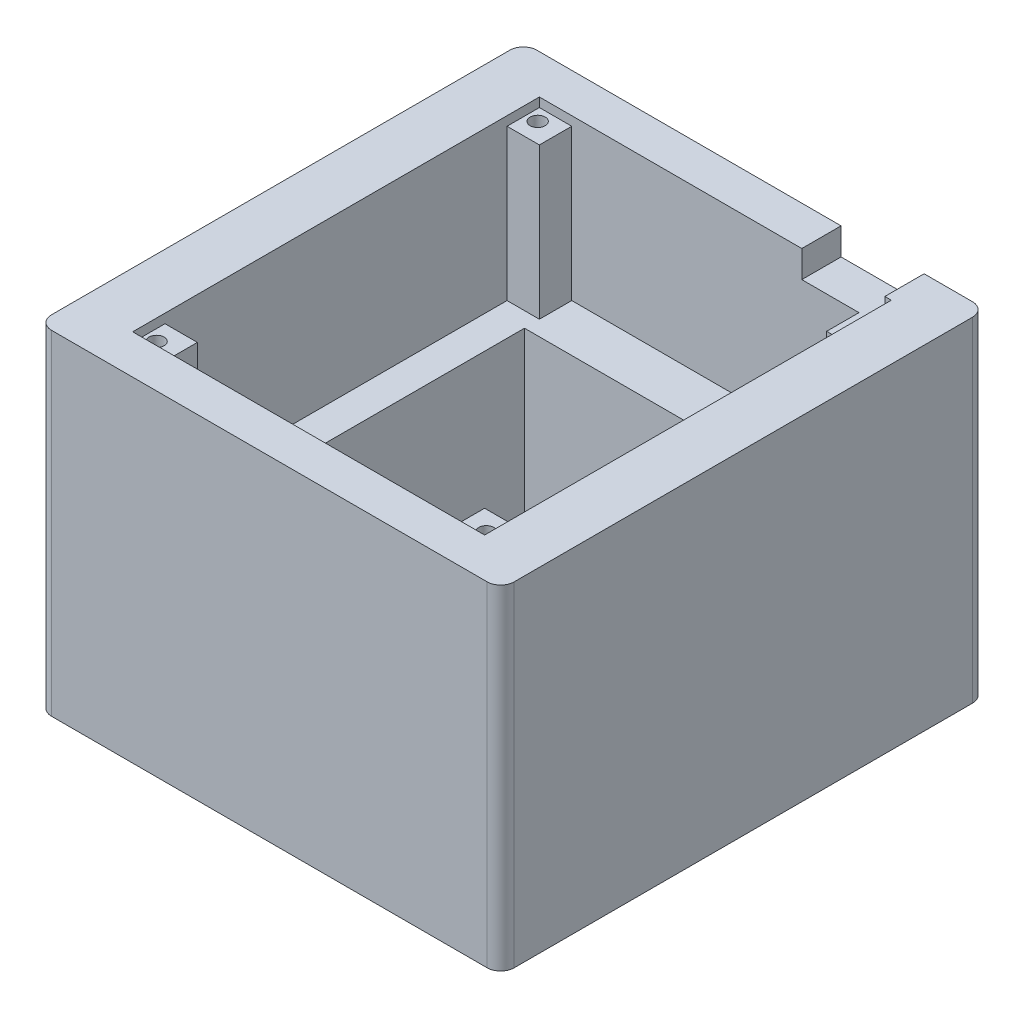
from build123d import *

# Parameters (mm, degrees)
SKETCH_1_W          = 85.8
SKETCH_1_H          = 90
SKETCH_1_R          = 1.33793637
SKETCH_1_W_2        = 53.17
SKETCH_1_H_2        = 57.8
EXTRUDE_1_DEPTH     = 20
SKETCH_3_W          = 85.8
SKETCH_3_H          = 90
SKETCH_3_W_2        = 53.17
SKETCH_3_H_2        = 57.8
EXTRUDE_2_DEPTH     = 42
SKETCH_5_R          = 1.4
CUT_EXTRUDE_2_DEPTH = 20
SKETCH_5_6_W        = 65.278
SKETCH_5_6_H        = 75.438
CUT_EXTRUDE_3_DEPTH = 1.7
CUT_EXTRUDE_4_DEPTH = 28
SKETCH_8_W          = 15.4
SKETCH_8_H          = 7.281
CUT_EXTRUDE_5_DEPTH = 5
FILLET_1_R          = 2.5
FILLET_2_R          = 2.5
FILLET_3_R          = 2.5
FILLET_4_R          = 2.5
SKETCH_11_W         = 4.79539709
SKETCH_11_H         = 3.3
CUT_EXTRUDE_6_DEPTH = 10


with BuildPart() as part:
    # 草图1 → 凸台-拉伸1 (new body)
    with BuildSketch(Plane(origin=(0, 0, 0), x_dir=(1, 0, 0), z_dir=(0, 1, 0))):
        with Locations((38.264980184, 40.138091102)):
            Rectangle(SKETCH_1_W, SKETCH_1_H)
        with Locations((1.744980184, 9.838091102)):
            Circle(SKETCH_1_R, mode=Mode.SUBTRACT)
        with Locations((74.784980184, 9.838091102)):
            Circle(SKETCH_1_R, mode=Mode.SUBTRACT)
        with Locations((74.784980184, 70.438091102)):
            Circle(SKETCH_1_R, mode=Mode.SUBTRACT)
        with Locations((1.744980184, 70.438091102)):
            Circle(SKETCH_1_R, mode=Mode.SUBTRACT)
        with Locations((38.264980184, 40.138091102)):
            Rectangle(SKETCH_1_W_2, SKETCH_1_H_2, mode=Mode.SUBTRACT)
    extrude(amount=EXTRUDE_1_DEPTH)

    # 草图3 → 凸台-拉伸2 (add)
    with BuildSketch(Plane(origin=(0, 20, 0), x_dir=(1, 0, 0), z_dir=(0, 1, 0))):
        with Locations((38.264980184, 40.138091102)):
            Rectangle(SKETCH_3_W, SKETCH_3_H)
        with Locations((38.264980184, 40.138091102)):
            Rectangle(SKETCH_3_W_2, SKETCH_3_H_2, mode=Mode.SUBTRACT)
    extrude(amount=EXTRUDE_2_DEPTH)

    # 草图5 → 切除-拉伸2 (cut)
    with BuildSketch(Plane(origin=(0, 62, 0), x_dir=(1, 0, 0), z_dir=(0, 1, 0))):
        with Locations((7.68587004, 75.476595821)):
            Circle(SKETCH_5_R)
        with Locations((68.844090328, 75.476595821)):
            Circle(SKETCH_5_R)
        with Locations((68.844090328, 4.799586383)):
            Circle(SKETCH_5_R)
        with Locations((7.68587004, 4.799586383)):
            Circle(SKETCH_5_R)
    extrude(amount=-CUT_EXTRUDE_2_DEPTH, mode=Mode.SUBTRACT)

    # 草图5<6> → 切除-拉伸3 (cut)
    with BuildSketch(Plane(origin=(0, 62, 0), x_dir=(1, 0, 0), z_dir=(0, 1, 0))):
        with Locations((38.264980184, 40.138091102)):
            Rectangle(SKETCH_5_6_W, SKETCH_5_6_H)
    extrude(amount=-CUT_EXTRUDE_3_DEPTH, mode=Mode.SUBTRACT)

    # 草图7 → 切除-拉伸4 (cut)
    with BuildSketch(Plane(origin=(0, 60.3, 0), x_dir=(1, 0, 0), z_dir=(0, 1, 0))):
        Polygon((5.625980184, 71.857091102), (11.625980184, 71.857091102), (11.625980184, 77.857091102), (64.90160291, 77.857091102), (64.90160291, 71.857091102), (70.90160291, 71.857091102), (70.903980184, 8.419091102), (64.903980184, 8.419091102), (64.903980184, 2.419091102), (11.625980184, 2.419091102), (11.625980184, 8.419091102), (5.625980184, 8.419091102), align=None)
    extrude(amount=-CUT_EXTRUDE_4_DEPTH, mode=Mode.SUBTRACT)

    # 草图8 → 切除-拉伸5 (cut)
    with BuildSketch(Plane(origin=(0, 62, 0), x_dir=(1, 0, 0), z_dir=(0, 1, 0))):
        with Locations((61.997, 81.497591102)):
            Rectangle(SKETCH_8_W, SKETCH_8_H)
    extrude(amount=-CUT_EXTRUDE_5_DEPTH, mode=Mode.SUBTRACT)

    # 圆角1
    fillet_1_edges = [part.edges().sort_by_distance(p)[0] for p in [
        (-4.635019816, 31, -85.138091102),
    ]]
    fillet(fillet_1_edges, radius=FILLET_1_R)

    # 圆角2
    fillet_2_edges = [part.edges().sort_by_distance(p)[0] for p in [
        (81.164980184, 31, -85.138091102),
    ]]
    fillet(fillet_2_edges, radius=FILLET_2_R)

    # 圆角3
    fillet_3_edges = [part.edges().sort_by_distance(p)[0] for p in [
        (81.164980184, 31, 4.861908898),
    ]]
    fillet(fillet_3_edges, radius=FILLET_3_R)

    # 圆角4
    fillet_4_edges = [part.edges().sort_by_distance(p)[0] for p in [
        (-4.635019816, 31, 4.861908898),
    ]]
    fillet(fillet_4_edges, radius=FILLET_4_R)

    # 草图11 → 切除-拉伸6 (cut)
    with BuildSketch(Plane(origin=(0, 0, -77.857091102), x_dir=(-1, 0, 0), z_dir=(0, 0, -1))):
        with Locations((-67.299301455, 58.65)):
            Rectangle(SKETCH_11_W, SKETCH_11_H)
    extrude(amount=-CUT_EXTRUDE_6_DEPTH, mode=Mode.SUBTRACT)


solid = part.part
